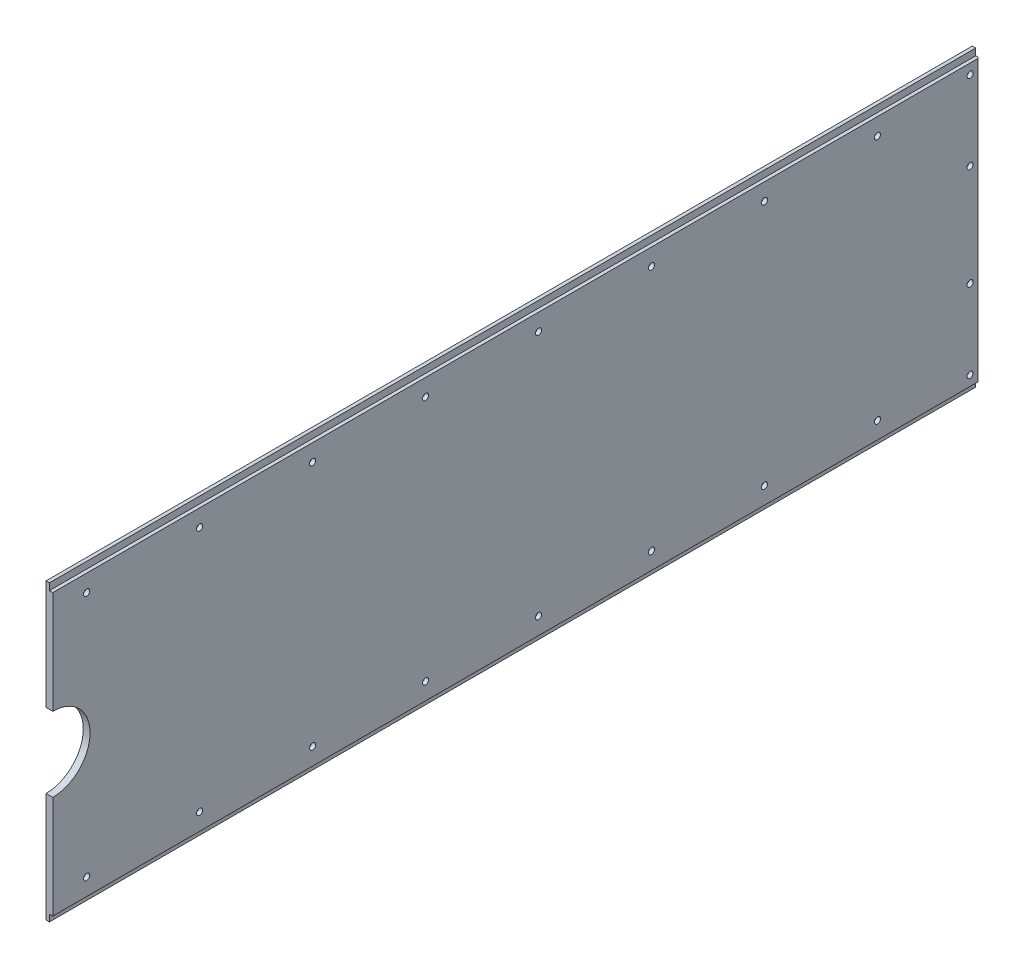
from build123d import *

# Parameters (mm, degrees)
BOSS_EXTRUDE1_DEPTH                                  = 6
SKIZZE1_W                                            = 3
SKIZZE1_H                                            = 6
SCHNITT_LINEAR_AUSTRAGEN1_DEPTH                      = 831.262609058
FORMSENKUNG_FUR_M5_LINSENSENKSCHRAUBE_MI_D           = 5.5
FORMSENKUNG_FUR_M5_LINSENSENKSCHRAUBE_MI_CSINK_D     = 10.4
FORMSENKUNG_FUR_M5_LINSENSENKSCHRAUBE_MI_CSINK_ANGLE = 90
CHAMFER1_SIZE                                        = 1
CSK_FOR_M5_COUNTERSUNK_RAISED_HEAD_SCREW_D           = 5.5
CSK_FOR_M5_COUNTERSUNK_RAISED_HEAD_SCREW_CSINK_D     = 10.4
CSK_FOR_M5_COUNTERSUNK_RAISED_HEAD_SCREW_CSINK_ANGLE = 90
LPATTERN1_COUNT                                      = 8
LPATTERN1_PITCH                                      = 100
SPIEGELN1_COPY_1_D                                   = 5.5
SPIEGELN1_COPY_1_CSINK_D                             = 10.4
SPIEGELN1_COPY_1_CSINK_ANGLE                         = 90
SPIEGELN1_COPY_2_D                                   = 5.5
SPIEGELN1_COPY_2_CSINK_D                             = 10.4
SPIEGELN1_COPY_2_CSINK_ANGLE                         = 90
SPIEGELN1_COPY_3_D                                   = 5.5
SPIEGELN1_COPY_3_CSINK_D                             = 10.4
SPIEGELN1_COPY_3_CSINK_ANGLE                         = 90
SPIEGELN1_COPY_4_D                                   = 5.5
SPIEGELN1_COPY_4_CSINK_D                             = 10.4
SPIEGELN1_COPY_4_CSINK_ANGLE                         = 90
SPIEGELN1_COPY_5_D                                   = 5.5
SPIEGELN1_COPY_5_CSINK_D                             = 10.4
SPIEGELN1_COPY_5_CSINK_ANGLE                         = 90
SPIEGELN1_COPY_6_D                                   = 5.5
SPIEGELN1_COPY_6_CSINK_D                             = 10.4
SPIEGELN1_COPY_6_CSINK_ANGLE                         = 90
SPIEGELN1_COPY_7_D                                   = 5.5
SPIEGELN1_COPY_7_CSINK_D                             = 10.4
SPIEGELN1_COPY_7_CSINK_ANGLE                         = 90


with BuildPart() as part:
    # Sketch1 → Boss-Extrude1 (new body)
    with BuildSketch(Plane(origin=(0, 0, 0), x_dir=(0, 0, -1), z_dir=(1, 0, 0))):
        with BuildLine():
            Line((-410, 130), (410, 130))
            Line((410, 130), (410, -130))
            Line((410, -130), (-410, -130))
            Line((-410, -130), (-410, -33))
            ThreePointArc((-410, -33), (-377, 0), (-410, 33))
            Line((-410, 33), (-410, 130))
        make_face()
    extrude(amount=BOSS_EXTRUDE1_DEPTH)

    # Skizze1 → Schnitt-Linear austragen1 (cut, through all)
    with BuildSketch(Plane.XY.offset(410)):
        with Locations((4.5, -127)):
            Rectangle(SKIZZE1_W, SKIZZE1_H)
        with Locations((4.5, 127)):
            Rectangle(SKIZZE1_W, SKIZZE1_H)
    extrude(amount=-SCHNITT_LINEAR_AUSTRAGEN1_DEPTH, mode=Mode.SUBTRACT)

    # Formsenkung fur M5 Linsensenkschraube mit Schlitz1 (through all)
    with Locations(Plane.ZY):
        with Locations((-402, -115), (-402, -45)):
            formsenkung_fur_m5_linsensenkschraube_mi = CounterSinkHole(FORMSENKUNG_FUR_M5_LINSENSENKSCHRAUBE_MI_D / 2, FORMSENKUNG_FUR_M5_LINSENSENKSCHRAUBE_MI_CSINK_D / 2, counter_sink_angle=FORMSENKUNG_FUR_M5_LINSENSENKSCHRAUBE_MI_CSINK_ANGLE)

    # Chamfer1
    chamfer1_edges = [part.edges().sort_by_distance(p)[0] for p in [
        (6, 0, -410),
    ]]
    chamfer(chamfer1_edges, length=CHAMFER1_SIZE)

    # CSK for M5 Countersunk Raised Head Screw1 (through all)
    with Locations(Plane.ZY):
        with Locations((-320, 109)):
            csk_for_m5_countersunk_raised_head_screw = CounterSinkHole(CSK_FOR_M5_COUNTERSUNK_RAISED_HEAD_SCREW_D / 2, CSK_FOR_M5_COUNTERSUNK_RAISED_HEAD_SCREW_CSINK_D / 2, counter_sink_angle=CSK_FOR_M5_COUNTERSUNK_RAISED_HEAD_SCREW_CSINK_ANGLE)

    # LPattern1: CSK for M5 Countersunk Raised Head Screw1 ×8
    with Locations(*[(0, 0, i * LPATTERN1_PITCH) for i in range(1, LPATTERN1_COUNT)]):
        add(csk_for_m5_countersunk_raised_head_screw, mode=Mode.SUBTRACT)

    # Spiegeln1: Formsenkung fur M5 Linsensenkschraube mit Schlitz1, CSK for M5 Countersunk Raised Head Screw1 across plane
    add(formsenkung_fur_m5_linsensenkschraube_mi.mirror(Plane.ZX), mode=Mode.SUBTRACT)
    add(csk_for_m5_countersunk_raised_head_screw.mirror(Plane.ZX), mode=Mode.SUBTRACT)

    # Spiegeln1 copy 1 (through all)
    with Locations(Plane(origin=(0, 0, 100), x_dir=(0, 0, 1), z_dir=(-1, 0, 0))):
        with Locations((-320, -109)):
            CounterSinkHole(SPIEGELN1_COPY_1_D / 2, SPIEGELN1_COPY_1_CSINK_D / 2, counter_sink_angle=SPIEGELN1_COPY_1_CSINK_ANGLE)

    # Spiegeln1 copy 2 (through all)
    with Locations(Plane(origin=(0, 0, 200), x_dir=(0, 0, 1), z_dir=(-1, 0, 0))):
        with Locations((-320, -109)):
            CounterSinkHole(SPIEGELN1_COPY_2_D / 2, SPIEGELN1_COPY_2_CSINK_D / 2, counter_sink_angle=SPIEGELN1_COPY_2_CSINK_ANGLE)

    # Spiegeln1 copy 3 (through all)
    with Locations(Plane(origin=(0, 0, 300), x_dir=(0, 0, 1), z_dir=(-1, 0, 0))):
        with Locations((-320, -109)):
            CounterSinkHole(SPIEGELN1_COPY_3_D / 2, SPIEGELN1_COPY_3_CSINK_D / 2, counter_sink_angle=SPIEGELN1_COPY_3_CSINK_ANGLE)

    # Spiegeln1 copy 4 (through all)
    with Locations(Plane(origin=(0, 0, 400), x_dir=(0, 0, 1), z_dir=(-1, 0, 0))):
        with Locations((-320, -109)):
            CounterSinkHole(SPIEGELN1_COPY_4_D / 2, SPIEGELN1_COPY_4_CSINK_D / 2, counter_sink_angle=SPIEGELN1_COPY_4_CSINK_ANGLE)

    # Spiegeln1 copy 5 (through all)
    with Locations(Plane(origin=(0, 0, 500), x_dir=(0, 0, 1), z_dir=(-1, 0, 0))):
        with Locations((-320, -109)):
            CounterSinkHole(SPIEGELN1_COPY_5_D / 2, SPIEGELN1_COPY_5_CSINK_D / 2, counter_sink_angle=SPIEGELN1_COPY_5_CSINK_ANGLE)

    # Spiegeln1 copy 6 (through all)
    with Locations(Plane(origin=(0, 0, 600), x_dir=(0, 0, 1), z_dir=(-1, 0, 0))):
        with Locations((-320, -109)):
            CounterSinkHole(SPIEGELN1_COPY_6_D / 2, SPIEGELN1_COPY_6_CSINK_D / 2, counter_sink_angle=SPIEGELN1_COPY_6_CSINK_ANGLE)

    # Spiegeln1 copy 7 (through all)
    with Locations(Plane(origin=(0, 0, 700), x_dir=(0, 0, 1), z_dir=(-1, 0, 0))):
        with Locations((-320, -109)):
            CounterSinkHole(SPIEGELN1_COPY_7_D / 2, SPIEGELN1_COPY_7_CSINK_D / 2, counter_sink_angle=SPIEGELN1_COPY_7_CSINK_ANGLE)


solid = part.part
